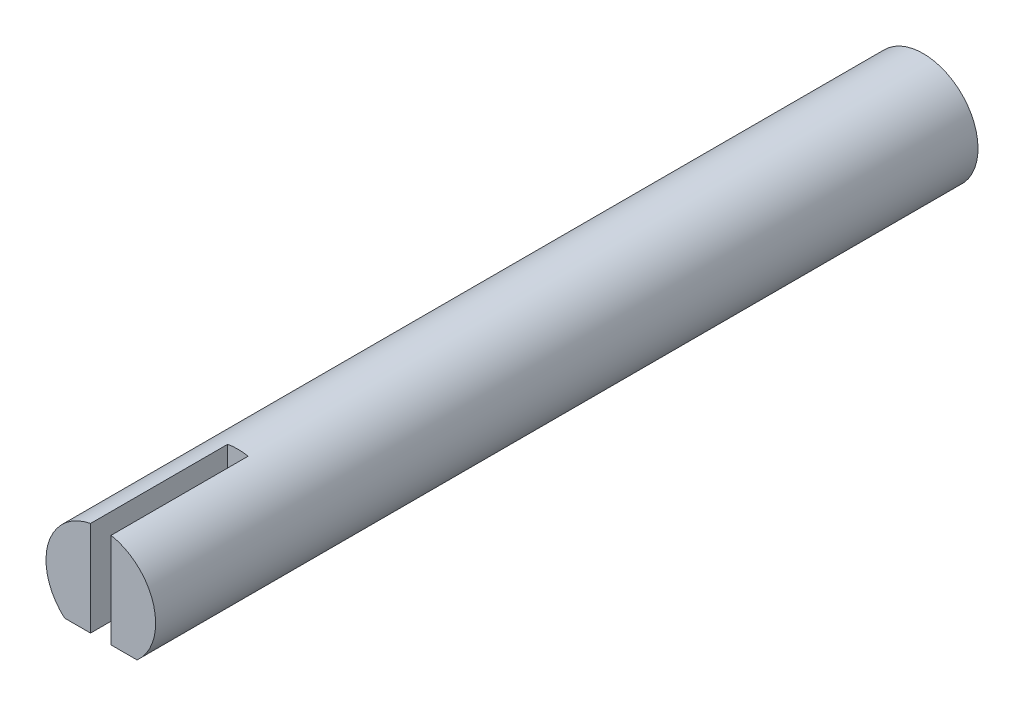
from build123d import *

# Parameters (mm, degrees)
BOSS_EXTRUDE1_DEPTH = 60
SKETCH2_W           = 1.5
SKETCH2_H           = 8
CUT_EXTRUDE1_DEPTH  = 10


with BuildPart() as part:
    # Sketch1 → Boss-Extrude1 (new body)
    with BuildSketch(Plane.XY):
        with BuildLine():
            Line((-2.645751311, -3), (2.645751311, -3))
            ThreePointArc((2.645751311, -3), (0, 4), (-2.645751311, -3))
        make_face()
    extrude(amount=BOSS_EXTRUDE1_DEPTH)

    # Sketch2 → Cut-Extrude1 (cut)
    with BuildSketch(Plane.XY.offset(60)):
        Rectangle(SKETCH2_W, SKETCH2_H)
    extrude(amount=-CUT_EXTRUDE1_DEPTH, mode=Mode.SUBTRACT)


solid = part.part
